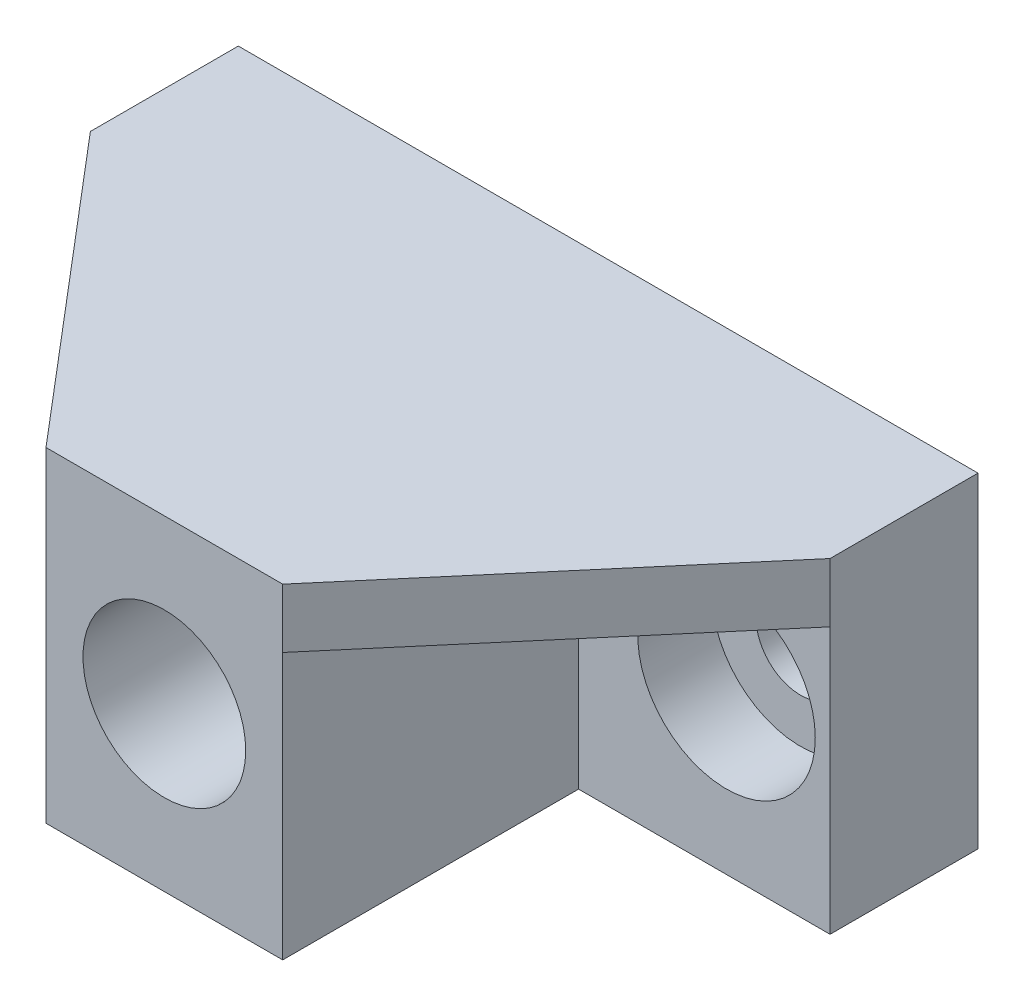
from build123d import *

# Parameters (mm, degrees)
SKETCH_1_W          = 8
SKETCH_1_H          = 22
EXTRUDE_1_DEPTH     = 10
SKETCH_1_3_W        = 8
SKETCH_1_3_H        = 22
EXTRUDE_2_DEPTH     = 30
EXTRUDE_3_DEPTH     = 4
SKETCH_3_R          = 6
CUT_EXTRUDE_1_DEPTH = 5
SKETCH_4_R          = 3
CUT_EXTRUDE_2_DEPTH = 31.618621785
SKETCH_5_R          = 5.5
CUT_EXTRUDE_3_DEPTH = 50.623583103
SKETCH_6_W          = 50
SKETCH_6_H          = 10
CUT_EXTRUDE_4_DEPTH = 3


with BuildPart() as part:
    # Эскиз1 → Бобышка-Вытянуть1 (new body)
    with BuildSketch(Plane.XY):
        Polygon((-12.5, -9.5), (-12.5, -12.5), (12.5, -12.5), (12.5, 12.5), (-4.5, 12.5), (-4.5, -9.5), align=None)
        with Locations((-8.5, 1.5)):
            Rectangle(SKETCH_1_W, SKETCH_1_H)
    extrude_1 = extrude(amount=EXTRUDE_1_DEPTH)

    # Эскиз1<3> → Бобышка-Вытянуть2 (add)
    with BuildSketch(Plane.XY):
        with Locations((-8.5, 1.5)):
            Rectangle(SKETCH_1_3_W, SKETCH_1_3_H)
    extrude_2 = extrude(amount=EXTRUDE_2_DEPTH)

    # Эскиз2 → Бобышка-Вытянуть3 (add)
    with BuildSketch(Plane(origin=(0, 12.5, 0), x_dir=(1, 0, 0), z_dir=(0, 1, 0))):
        Polygon((12.5, -10), (-4.5, -30), (-4.5, -10), align=None)
    extrude_3 = extrude(amount=-EXTRUDE_3_DEPTH)

    # Эскиз3 → Вырез-Вытянуть1 (cut)
    with BuildSketch(Plane.XY.offset(10)):
        with Locations((5.5, 1.5)):
            Circle(SKETCH_3_R)
    cut_extrude_1 = extrude(amount=-CUT_EXTRUDE_1_DEPTH, mode=Mode.SUBTRACT)

    # Эскиз4 → Вырез-Вытянуть2 (cut, through all)
    with BuildSketch(Plane.XY.offset(5)):
        with Locations((5.5, 1.5)):
            Circle(SKETCH_4_R)
    cut_extrude_2 = extrude(amount=-CUT_EXTRUDE_2_DEPTH, mode=Mode.SUBTRACT)

    # Зеркальное отражение1: Бобышка-Вытянуть1, Бобышка-Вытянуть2, Бобышка-Вытянуть3, Вырез-Вытянуть1, Вырез-Вытянуть2 across plane
    add(extrude_1.mirror(Plane(origin=(-12.5, 0, 10), x_dir=(0, 0, 1), z_dir=(-1, 0, 0))))
    add(extrude_2.mirror(Plane(origin=(-12.5, 0, 10), x_dir=(0, 0, 1), z_dir=(-1, 0, 0))))
    add(extrude_3.mirror(Plane(origin=(-12.5, 0, 10), x_dir=(0, 0, 1), z_dir=(-1, 0, 0))))
    add(cut_extrude_1.mirror(Plane(origin=(-12.5, 0, 10), x_dir=(0, 0, 1), z_dir=(-1, 0, 0))), mode=Mode.SUBTRACT)
    add(cut_extrude_2.mirror(Plane(origin=(-12.5, 0, 10), x_dir=(0, 0, 1), z_dir=(-1, 0, 0))), mode=Mode.SUBTRACT)

    # Эскиз5 → Вырез-Вытянуть3 (cut, through all)
    with BuildSketch(Plane.XY.offset(30)):
        with Locations((-12.5, 1.5)):
            Circle(SKETCH_5_R)
    extrude(amount=-CUT_EXTRUDE_3_DEPTH, mode=Mode.SUBTRACT)

    # Эскиз6 → Вырез-Вытянуть4 (cut)
    with BuildSketch(Plane.XZ.offset(12.5)):
        with Locations((-12.5, 5)):
            Rectangle(SKETCH_6_W, SKETCH_6_H)
    extrude(amount=-CUT_EXTRUDE_4_DEPTH, mode=Mode.SUBTRACT)


solid = part.part
